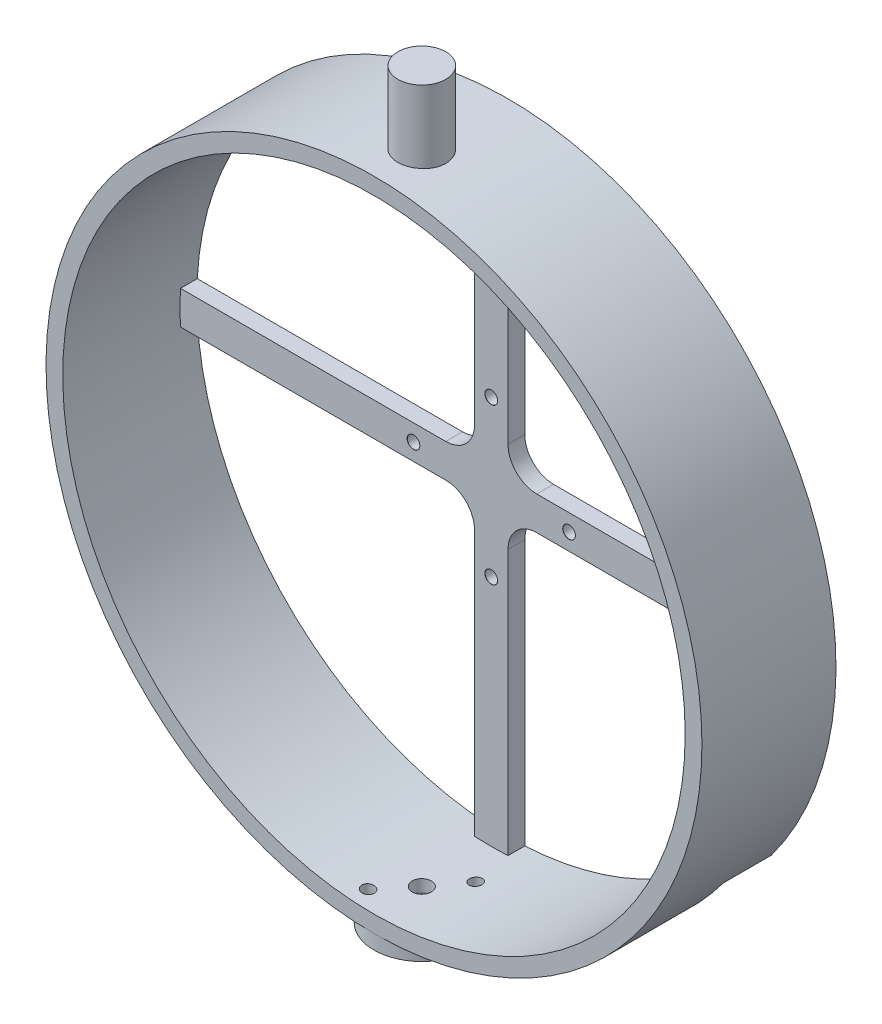
from build123d import *

# Parameters (mm, degrees)
ESQUISSE1_R                  = 68.5
ESQUISSE1_R_2                = 65
BOSS_EXTRU_1_DEPTH           = 28
BOSS_EXTRU_2_DEPTH           = 3.5
ESQUISSE3_W                  = 10
ESQUISSE3_H                  = 4
ESQUISSE3_W_2                = 5
ESQUISSE3_H_2                = 16
D_GAGEMENT_M21_AT_2_COUNT    = 2
D_GAGEMENT_M21_AT_2_PITCH    = 16
ENL_V_MAT_EXTRU_2_DEPTH      = 10
ENL_V_MAT_EXTRU_2_DEPTH_BACK = 3.5
ESQUISSE8_R                  = 2
ENL_V_MAT_EXTRU_4_DEPTH      = 13.5
ENL_V_MAT_EXTRU_4_DEPTH_BACK = 13.5
ESQUISSE9_W                  = 20
ESQUISSE9_H                  = 20
D_GAGEMENT_M23_AT_2_COUNT    = 2
D_GAGEMENT_M23_AT_2_PITCH    = 22.980970389
D_GAGEMENT_M23_AT_3_COUNT    = 2
D_GAGEMENT_M23_AT_3_PITCH    = 32.5
D_GAGEMENT_M23_AT_4_COUNT    = 2
D_GAGEMENT_M23_AT_4_PITCH    = 22.980970389


with BuildPart() as part:
    # Esquisse1 → Boss.-Extru.1 (new body)
    with BuildSketch(Plane.XY):
        Circle(ESQUISSE1_R)
        Circle(ESQUISSE1_R_2, mode=Mode.SUBTRACT)
    extrude(amount=BOSS_EXTRU_1_DEPTH)

    # Esquisse2 → Boss.-Extru.2 (add)
    with BuildSketch(Plane(origin=(0, 0, 0), x_dir=(-1, 0, 0), z_dir=(0, 0, -1))):
        with BuildLine():
            Line((-3.5, 64.905700828), (-3.5, 9.5))
            ThreePointArc((-3.5, 9.5), (-5.257359313, 5.257359313), (-9.5, 3.5))
            Line((-9.5, 3.5), (-64.905700828, 3.5))
            ThreePointArc((-64.905700828, 3.5), (-65, 0), (-64.905700828, -3.5))
            Line((-64.905700828, -3.5), (-9.5, -3.5))
            ThreePointArc((-9.5, -3.5), (-5.257359313, -5.257359313), (-3.5, -9.5))
            Line((-3.5, -9.5), (-3.5, -64.905700828))
            ThreePointArc((-3.5, -64.905700828), (0, -65), (3.5, -64.905700828))
            Line((3.5, -64.905700828), (3.5, -9.5))
            ThreePointArc((3.5, -9.5), (5.257359313, -5.257359313), (9.5, -3.5))
            Line((9.5, -3.5), (64.905700828, -3.5))
            ThreePointArc((64.905700828, -3.5), (65, 0), (64.905700828, 3.5))
            Line((64.905700828, 3.5), (9.5, 3.5))
            ThreePointArc((9.5, 3.5), (5.257359313, 5.257359313), (3.5, 9.5))
            Line((3.5, 9.5), (3.5, 64.905700828))
            ThreePointArc((3.5, 64.905700828), (0, 65), (-3.5, 64.905700828))
        make_face()
    extrude(amount=-BOSS_EXTRU_2_DEPTH)


with BuildPart() as body_2:
    # Esquisse3 → Révolution1 (revolve)
    with BuildSketch(Plane(origin=(0, 0, 0), x_dir=(0, 0, -1), z_dir=(1, 0, 0))):
        with Locations((-13, -69.5)):
            Rectangle(ESQUISSE3_W, ESQUISSE3_H)
        with Locations((-15.5, 75.5)):
            Rectangle(ESQUISSE3_W_2, ESQUISSE3_H_2)
    revolve(axis=Axis((0, -71.5, 18), (0, 1, 0)))


with BuildPart() as d_gagement_m21_tool:
    # Esquisse5 → Dégagement M21 (revolve)
    with BuildSketch(Plane(origin=(4.950542853, -71.5, 11.715723951), x_dir=(0, 0, -1), z_dir=(1, 0, 0))):
        Polygon((0, 0), (0, 10.781118805), (1.3, 10), (1.3, 0.025), (1.325, 0), align=None)
    d_gagement_m21 = revolve(axis=Axis((4.950542853, -77.85, 11.715723951), (0, 1, 0)))


with BuildPart() as part_1:
    add(part.part)

    # Dégagement M21: cut by d_gagement_m21_tool
    add(d_gagement_m21_tool.part, mode=Mode.SUBTRACT)


with BuildPart() as body_2_1:
    add(body_2.part)

    # Dégagement M21: cut by d_gagement_m21_tool
    add(d_gagement_m21_tool.part, mode=Mode.SUBTRACT)


with BuildPart() as d_gagement_m21_at_2_tool:
    # Dégagement M21 at 2: Dégagement M21 ×2
    with Locations(*[Vector(-0.6188178566872944, 0, 0.785534506081651) * (i * D_GAGEMENT_M21_AT_2_PITCH) for i in range(1, D_GAGEMENT_M21_AT_2_COUNT)]):
        add(d_gagement_m21)


with BuildPart() as part_2:
    add(part_1.part)

    # Dégagement M21 at 2: cut by d_gagement_m21_at_2_tool
    add(d_gagement_m21_at_2_tool.part, mode=Mode.SUBTRACT)


with BuildPart() as body_2_2:
    add(body_2_1.part)

    # Dégagement M21 at 2: cut by d_gagement_m21_at_2_tool
    add(d_gagement_m21_at_2_tool.part, mode=Mode.SUBTRACT)


with BuildPart() as d_gagement_m22_tool:
    # Esquisse7 → Dégagement M22 (revolve)
    with BuildSketch(Plane(origin=(0, -71.5, 18), x_dir=(0, 0, -1), z_dir=(1, 0, 0))):
        Polygon((0, 0), (0, 10.781118805), (1.3, 10), (1.3, 0.025), (1.325, 0), align=None)
    revolve(axis=Axis((0, -77.85, 18), (0, 1, 0)))


with BuildPart() as part_3:
    add(part_2.part)

    # Dégagement M22: cut by d_gagement_m22_tool
    add(d_gagement_m22_tool.part, mode=Mode.SUBTRACT)


with BuildPart() as body_2_3:
    add(body_2_2.part)

    # Dégagement M22: cut by d_gagement_m22_tool
    add(d_gagement_m22_tool.part, mode=Mode.SUBTRACT)


with BuildPart() as enl_v_mat_extru_2_tool:
    # Esquisse8 → Enlèv. mat.-Extru.2 (new, two sides: drawn at the far end of the back side and taken through both)
    with BuildSketch(Plane(origin=(0, -65, 0), x_dir=(1, 0, 0), z_dir=(0, 1, 0)).offset(-ENL_V_MAT_EXTRU_2_DEPTH_BACK)):
        with Locations((0, -18)):
            Circle(ESQUISSE8_R)
    extrude(amount=ENL_V_MAT_EXTRU_2_DEPTH + ENL_V_MAT_EXTRU_2_DEPTH_BACK)


with BuildPart() as part_4:
    add(part_3.part)

    # Enlèv. mat.-Extru.2: cut by enl_v_mat_extru_2_tool
    add(enl_v_mat_extru_2_tool.part, mode=Mode.SUBTRACT)

    # Esquisse9 → Enlèv. mat.-Extru.4 (cut, two sides: drawn at the far end of the back side and taken through both)
    with BuildSketch(Plane(origin=(48.436814511, -48.436814511, 0), x_dir=(0, 0, -1), z_dir=(0.7071067811865511, -0.7071067811865439, 0)).offset(-ENL_V_MAT_EXTRU_4_DEPTH_BACK)):
        Rectangle(ESQUISSE9_W, ESQUISSE9_H)
    extrude(amount=ENL_V_MAT_EXTRU_4_DEPTH + ENL_V_MAT_EXTRU_4_DEPTH_BACK, mode=Mode.SUBTRACT)

    # Esquisse11 → Dégagement M23 (revolve, cut)
    with BuildSketch(Plane(origin=(-16.25, 0, 3.5), x_dir=(0, -1, 0), z_dir=(1, 0, 0))):
        Polygon((0, 0), (0, 10.781118805), (1.3, 10), (1.3, 0.025), (1.325, 0), align=None)
    d_gagement_m23 = revolve(axis=Axis((-16.25, 0, 9.85), (0, 0, -1)), mode=Mode.SUBTRACT)

    # Dégagement M23 at 2: Dégagement M23 ×2
    with Locations(*[Vector(0.7071067811865469, 0.7071067811865482, 0) * (i * D_GAGEMENT_M23_AT_2_PITCH) for i in range(1, D_GAGEMENT_M23_AT_2_COUNT)]):
        add(d_gagement_m23, mode=Mode.SUBTRACT)

    # Dégagement M23 at 3: Dégagement M23 ×2
    with Locations(*[(i * D_GAGEMENT_M23_AT_3_PITCH, 0, 0) for i in range(1, D_GAGEMENT_M23_AT_3_COUNT)]):
        add(d_gagement_m23, mode=Mode.SUBTRACT)

    # Dégagement M23 at 4: Dégagement M23 ×2
    with Locations(*[Vector(0.7071067811865505, -0.7071067811865446, 0) * (i * D_GAGEMENT_M23_AT_4_PITCH) for i in range(1, D_GAGEMENT_M23_AT_4_COUNT)]):
        add(d_gagement_m23, mode=Mode.SUBTRACT)


with BuildPart() as body_2_4:
    add(body_2_3.part)

    # Enlèv. mat.-Extru.2: cut by enl_v_mat_extru_2_tool
    add(enl_v_mat_extru_2_tool.part, mode=Mode.SUBTRACT)


solid = Compound([part_4.part, body_2_4.part])
